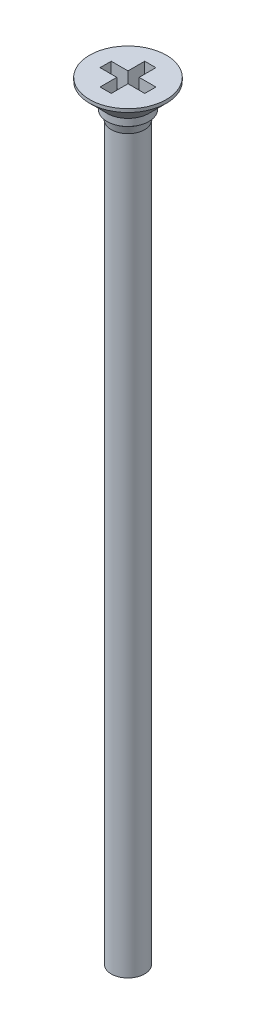
from build123d import *

# Parameters (mm, degrees)
KREUZSCHLITZ1_H_DEPTH      = 0.4
KREUZSCHLITZ1_H_DEPTH_BACK = 0.4
KREUZSCHLITZ2_H_DEPTH      = 0.4
KREUZSCHLITZ2_H_DEPTH_BACK = 0.4
BOSS_EXTRUDE1_START        = 47
SKETCH1_R                  = 1.1935
BOSS_EXTRUDE1_DEPTH        = 47


with BuildPart() as part:
    # Skizze1 → Basis-Rotation (revolve)
    with BuildSketch(Plane.XY, mode=Mode.PRIVATE) as basis_rotation_sk:
        Polygon((0, 0), (2.75, 0), (2.75, -0.2375), (1.5, -1.4875), (1.5, -1.9875), (1.3375, -1.9875), (1.3375, -2.112584684), (1.1935, -2.65), (1.1935, -8), (0, -8), align=None)
    revolve(basis_rotation_sk.sketch.rotate(Axis((0, 0, 0), (0, -1, 0)), 180), axis=Axis((0, 0, 0), (0, -1, 0)))

    # Skizze2 → Kreuzschlitz1 H (cut, two sides: drawn at the far end of the back side and taken through both)
    with BuildSketch(Plane.XY.offset(-KREUZSCHLITZ1_H_DEPTH_BACK)):
        Polygon((-0.55, -2.1), (0.55, -2.1), (1.6, -1.05), (1.6, 0), (-1.6, 0), (-1.6, -1.05), align=None)
    extrude(amount=KREUZSCHLITZ1_H_DEPTH + KREUZSCHLITZ1_H_DEPTH_BACK, mode=Mode.SUBTRACT)

    # Skizze3 → Kreuzschlitz2 H (cut, two sides: drawn at the far end of the back side and taken through both)
    with BuildSketch(Plane(origin=(0, 0, 0), x_dir=(0, 0, -1), z_dir=(1, 0, 0)).offset(-KREUZSCHLITZ2_H_DEPTH_BACK)):
        Polygon((-0.55, -2.1), (0.55, -2.1), (1.6, -1.05), (1.6, 0), (-1.6, 0), (-1.6, -1.05), align=None)
    extrude(amount=KREUZSCHLITZ2_H_DEPTH + KREUZSCHLITZ2_H_DEPTH_BACK, mode=Mode.SUBTRACT)

    # Sketch1 → Boss-Extrude1 (add)
    with BuildSketch(Plane.XZ.offset(8).offset(BOSS_EXTRUDE1_START)):
        with Locations(Location((0, 0, 0), (0, 0, 180))):
            Circle(SKETCH1_R)
    extrude(amount=-BOSS_EXTRUDE1_DEPTH)


solid = part.part
